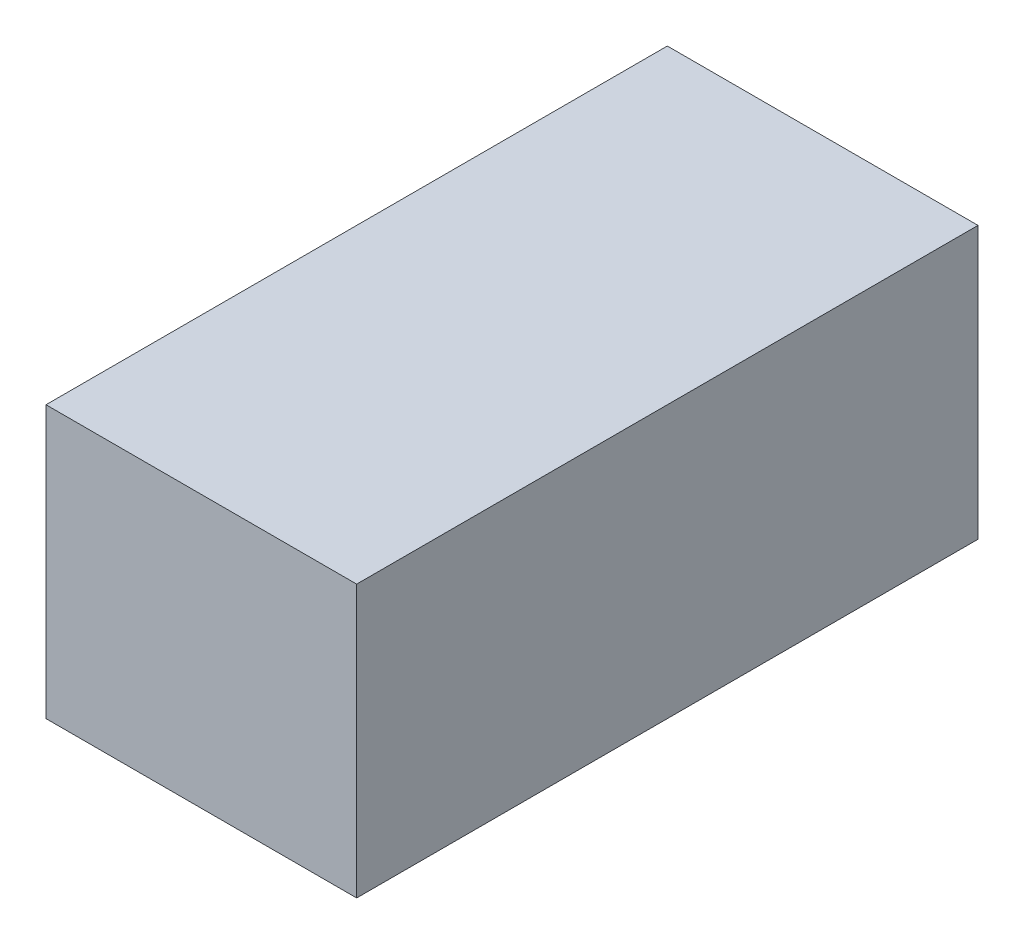
from build123d import *

# Parameters (mm, degrees)
SKETCH1_W           = 40
SKETCH1_H           = 35
BOSS_EXTRUDE1_DEPTH = 80


with BuildPart() as part:
    # Sketch1 → Boss-Extrude1 (new body)
    with BuildSketch(Plane.XY):
        Rectangle(SKETCH1_W, SKETCH1_H)
    extrude(amount=BOSS_EXTRUDE1_DEPTH)


solid = part.part
